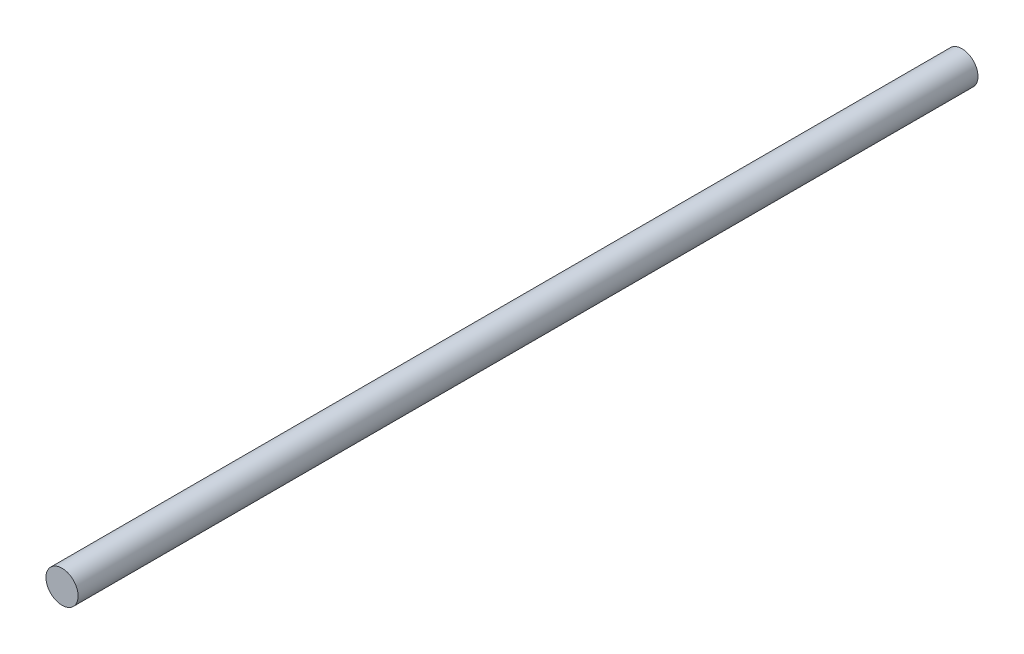
from build123d import *

# Parameters (mm, degrees)
SKETCH1_R           = 6.35
BOSS_EXTRUDE1_DEPTH = 355.6


with BuildPart() as part:
    # Sketch1 → Boss-Extrude1 (new body)
    with BuildSketch(Plane.XY):
        Circle(SKETCH1_R)
    extrude(amount=BOSS_EXTRUDE1_DEPTH)


solid = part.part
